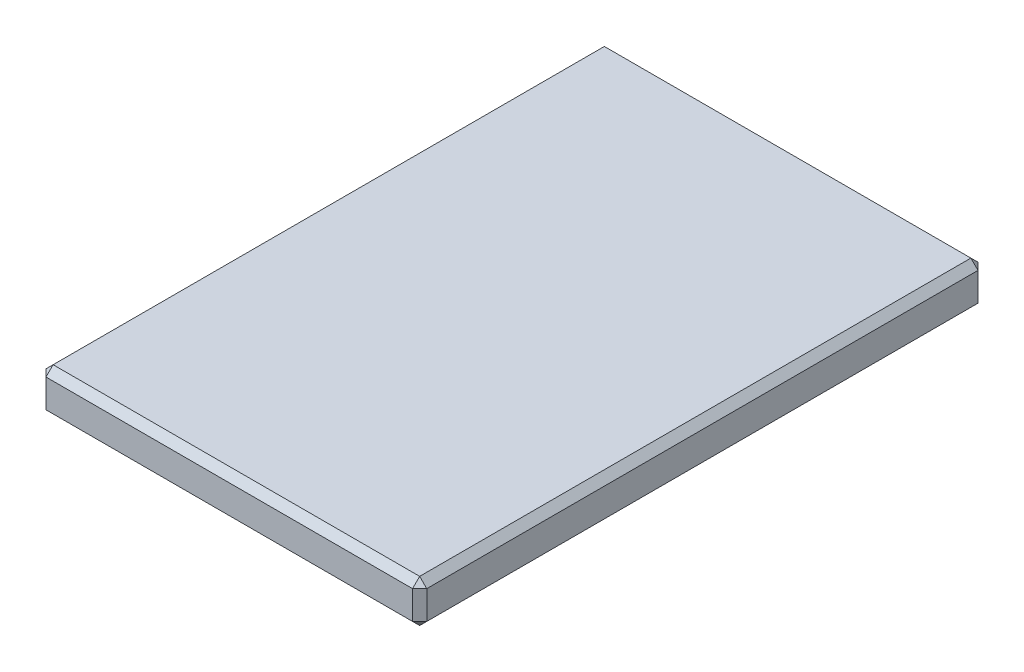
from build123d import *

# Parameters (mm, degrees)
SKETCH1_W           = 26.8
SKETCH1_H           = 39.8
BOSS_EXTRUDE1_DEPTH = 3
CHAMFER1_SIZE       = 0.5


with BuildPart() as part:
    # Sketch1 → Boss-Extrude1 (new body)
    with BuildSketch(Plane(origin=(0, 0, 0), x_dir=(1, 0, 0), z_dir=(0, 1, 0))):
        with Locations((13.4, -19.9)):
            Rectangle(SKETCH1_W, SKETCH1_H)
    extrude(amount=BOSS_EXTRUDE1_DEPTH)

    # Chamfer1
    chamfer1_edges = [part.edges().sort_by_distance(p)[0] for p in [
        (26.8, 3, 19.9),
        (13.4, 3, 0),
        (0, 3, 19.9),
        (13.4, 0, 0),
        (26.8, 0, 19.9),
        (13.4, 0, 39.8),
        (0, 0, 19.9),
        (13.4, 3, 39.8),
        (0, 1.5, 0),
        (26.8, 1.5, 0),
        (26.8, 1.5, 39.8),
        (0, 1.5, 39.8),
    ]]
    chamfer(chamfer1_edges, length=CHAMFER1_SIZE)


solid = part.part
